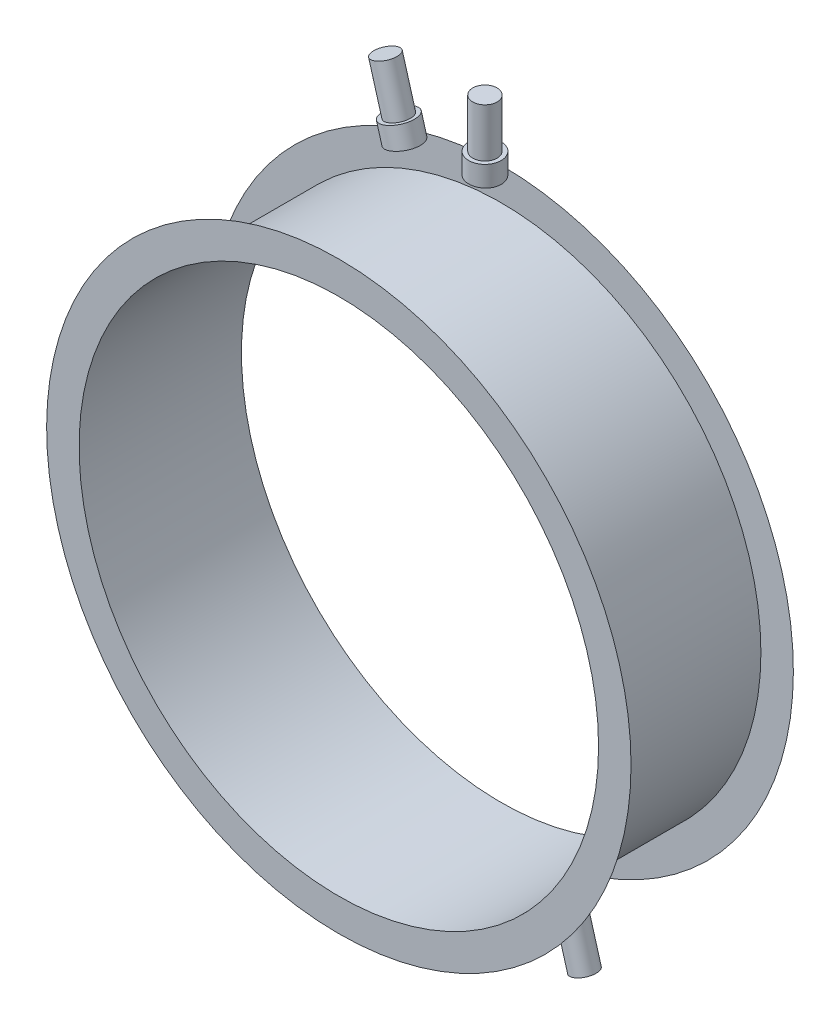
from build123d import *

# Parameters (mm, degrees)
SKETCH1_R           = 36
SKETCH1_R_2         = 32
BOSS_EXTRUDE1_DEPTH = 10
CIRPATTERN1_COUNT   = 2
CIRPATTERN1_ANGLE   = 16
CIRPATTERN2_COUNT   = 2


with BuildPart() as part:
    # Sketch1 → Boss-Extrude1 (new, symmetric)
    with BuildSketch(Plane.XY):
        Circle(SKETCH1_R)
        Circle(SKETCH1_R_2, mode=Mode.SUBTRACT)
    extrude(amount=BOSS_EXTRUDE1_DEPTH, both=True)

    # Sketch5 → Revolve1 (revolve)
    with BuildSketch(Plane(origin=(0, 0, 0), x_dir=(0, 0, -1), z_dir=(1, 0, 0))):
        Polygon((6, 32), (6, 38.5), (6.5, 38.5), (6.5, 44.5), (8, 44.5), (8, 32), align=None)
    revolve1 = revolve(axis=Axis((0, 44.5, -8), (0, -1, 0)))

    # CirPattern1: Revolve1 ×2 about axis
    cirpattern1_axis = Axis((0, 0, 10), (0, 0, 1))
    for i in range(1, CIRPATTERN1_COUNT):
        add(revolve1.rotate(cirpattern1_axis, i * CIRPATTERN1_ANGLE / (CIRPATTERN1_COUNT - 1)))

    # CirPattern2: Revolve1 ×2 about axis
    cirpattern2_axis = Axis((0, 0, 10), (0, 0, -1))
    for i in range(1, CIRPATTERN2_COUNT):
        add(revolve1.rotate(cirpattern2_axis, i * 360 / CIRPATTERN2_COUNT))

    # CirPattern2 copy 1 sketch → CirPattern2 copy 1 (revolve)
    with BuildSketch(Plane(origin=(0, 0, 0), x_dir=(0, 0, -1), z_dir=(-0.9612616959383187, -0.2756373558169999, 0))):
        Polygon((6, 32), (6, 38.5), (6.5, 38.5), (6.5, 44.5), (8, 44.5), (8, 32), align=None)
    revolve(axis=Axis((12.265862334, -42.776145469, -8), (-0.2756373558169999, 0.9612616959383187, 0)))


solid = part.part
